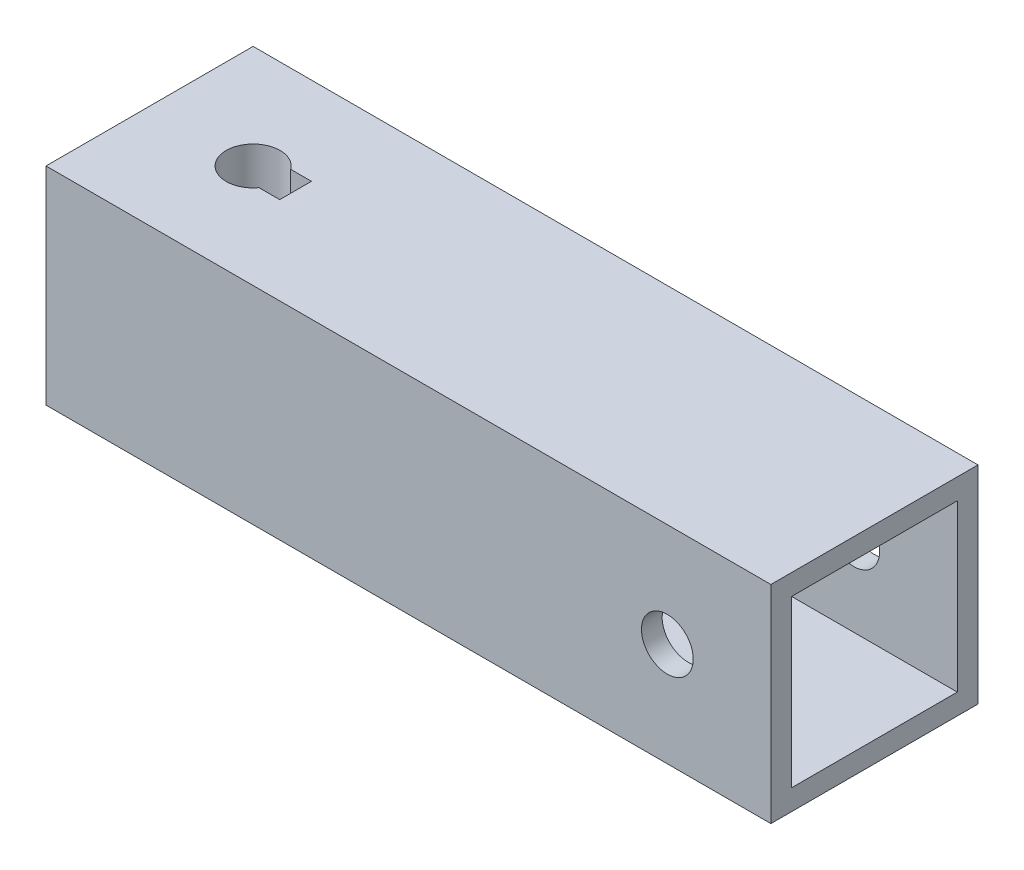
from build123d import *

# Parameters (mm, degrees)
SKETCH2_W               = 140
SKETCH2_H               = 40
SKETCH2_R               = 5.2
BOSS_EXTRUDE1_DEPTH     = 40
CUT_EXTRUDE1_DEPTH      = 84.066238629
CUT_EXTRUDE1_DEPTH_BACK = 84.066238629
SKETCH3_R               = 5
CUT_EXTRUDE5_DEPTH      = 84.066238629
CUT_EXTRUDE5_DEPTH_BACK = 84.066238629
SKETCH7_W               = 2
SKETCH7_H               = 6.131883886
CUT_EXTRUDE6_START      = 70
SKETCH8_W               = 32
SKETCH8_H               = 32
CUT_EXTRUDE6_DEPTH      = 80


with BuildPart() as part:
    # Sketch2 → Boss-Extrude1 (new body)
    with BuildSketch(Plane(origin=(0, 0, 0), x_dir=(1, 0, 0), z_dir=(0, 1, 0))):
        Rectangle(SKETCH2_W, SKETCH2_H)
        with Locations(Location((-50, 0, 0), (0, 0, 270))):
            Circle(SKETCH2_R, mode=Mode.SUBTRACT)
    extrude(amount=BOSS_EXTRUDE1_DEPTH)

    # Sketch3 → Cut-Extrude1 (cut, two sides: drawn at the far end of the back side and taken through both)
    with BuildSketch(Plane.XY.offset(-CUT_EXTRUDE1_DEPTH_BACK)):
        with Locations((50, 20)):
            Circle(SKETCH3_R)
    extrude(amount=CUT_EXTRUDE1_DEPTH + CUT_EXTRUDE1_DEPTH_BACK, mode=Mode.SUBTRACT)

    # Sketch7 → Cut-Extrude5 (cut, two sides: drawn at the far end of the back side and taken through both)
    with BuildSketch(Plane(origin=(0, 0, 0), x_dir=(1, 0, 0), z_dir=(0, 1, 0)).offset(-CUT_EXTRUDE5_DEPTH_BACK)):
        with Locations((-42.8, 0)):
            Rectangle(SKETCH7_W, SKETCH7_H)
        with Locations((-44.8, 0)):
            Rectangle(SKETCH7_W, SKETCH7_H)
    extrude(amount=CUT_EXTRUDE5_DEPTH + CUT_EXTRUDE5_DEPTH_BACK, mode=Mode.SUBTRACT)

    # Sketch8 → Cut-Extrude6 (cut)
    with BuildSketch(Plane(origin=(0, 0, 0), x_dir=(0, 0, -1), z_dir=(1, 0, 0)).offset(CUT_EXTRUDE6_START)):
        with Locations((0, 20)):
            Rectangle(SKETCH8_W, SKETCH8_H)
    extrude(amount=-CUT_EXTRUDE6_DEPTH, mode=Mode.SUBTRACT)


solid = part.part
